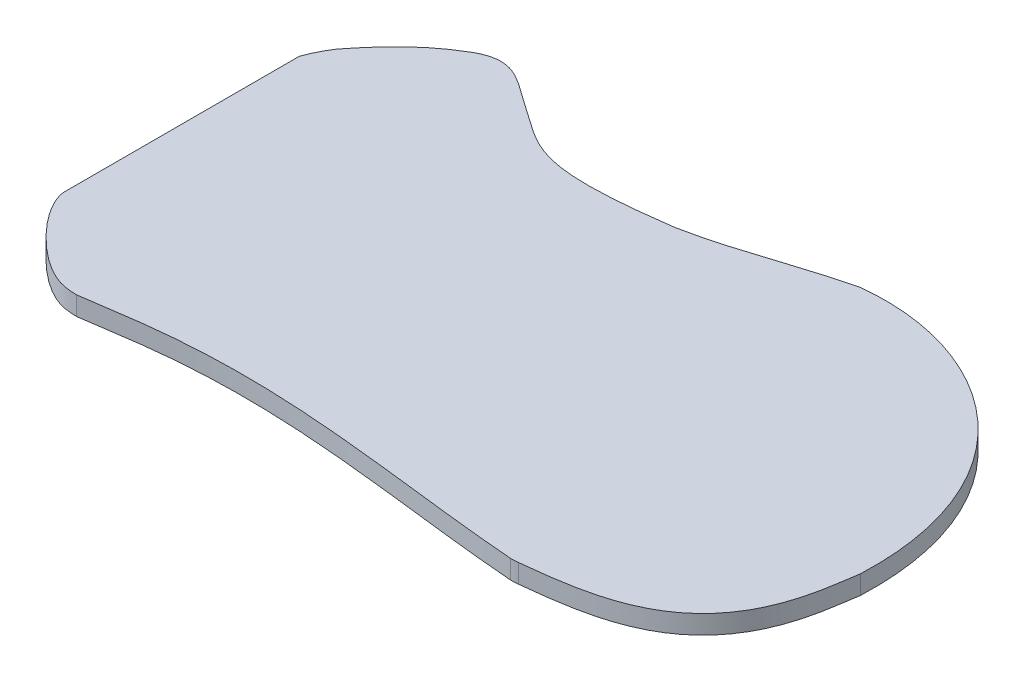
from build123d import *

# Parameters (mm, degrees)
BOSS_EXTRUDE2_DEPTH      = 4
SKETCH2_R                = 6
BOSS_EXTRUDE3_DEPTH      = 2.5
SKETCH4_R                = 2.5
CUT_EXTRUDE1_DEPTH       = 2.5
LPATTERN1_COUNT          = 3
LPATTERN1_PITCH          = 20
LPATTERN1_COUNT_DIR2     = 6
LPATTERN1_PITCH_DIR2     = 20
MIRROR1_COPY_1_SKETCH_R  = 6
MIRROR1_COPY_1_DEPTH     = 2.5
MIRROR1_COPY_2_SKETCH_R  = 6
MIRROR1_COPY_2_DEPTH     = 2.5
MIRROR1_COPY_3_SKETCH_R  = 6
MIRROR1_COPY_3_DEPTH     = 2.5
MIRROR1_COPY_4_SKETCH_R  = 6
MIRROR1_COPY_4_DEPTH     = 2.5
MIRROR1_COPY_5_SKETCH_R  = 6
MIRROR1_COPY_5_DEPTH     = 2.5
MIRROR1_COPY_6_SKETCH_R  = 6
MIRROR1_COPY_6_DEPTH     = 2.5
MIRROR1_COPY_7_SKETCH_R  = 6
MIRROR1_COPY_7_DEPTH     = 2.5
MIRROR1_COPY_8_SKETCH_R  = 6
MIRROR1_COPY_8_DEPTH     = 2.5
MIRROR1_COPY_9_SKETCH_R  = 6
MIRROR1_COPY_9_DEPTH     = 2.5
MIRROR1_COPY_10_SKETCH_R = 6
MIRROR1_COPY_10_DEPTH    = 2.5
MIRROR1_COPY_11_SKETCH_R = 6
MIRROR1_COPY_11_DEPTH    = 2.5
MIRROR1_COPY_12_SKETCH_R = 6
MIRROR1_COPY_12_DEPTH    = 2.5
MIRROR1_COPY_13_SKETCH_R = 6
MIRROR1_COPY_13_DEPTH    = 2.5
MIRROR1_COPY_14_SKETCH_R = 6
MIRROR1_COPY_14_DEPTH    = 2.5
MIRROR1_COPY_15_SKETCH_R = 6
MIRROR1_COPY_15_DEPTH    = 2.5
MIRROR1_COPY_16_SKETCH_R = 6
MIRROR1_COPY_16_DEPTH    = 2.5
MIRROR1_COPY_17_SKETCH_R = 6
MIRROR1_COPY_17_DEPTH    = 2.5
MIRROR1_COPY_18_SKETCH_R = 2.5
MIRROR1_COPY_18_DEPTH    = 2.5
MIRROR1_COPY_19_SKETCH_R = 2.5
MIRROR1_COPY_19_DEPTH    = 2.5
MIRROR1_COPY_20_SKETCH_R = 2.5
MIRROR1_COPY_20_DEPTH    = 2.5
MIRROR1_COPY_21_SKETCH_R = 2.5
MIRROR1_COPY_21_DEPTH    = 2.5
MIRROR1_COPY_22_SKETCH_R = 2.5
MIRROR1_COPY_22_DEPTH    = 2.5
MIRROR1_COPY_23_SKETCH_R = 2.5
MIRROR1_COPY_23_DEPTH    = 2.5
MIRROR1_COPY_24_SKETCH_R = 2.5
MIRROR1_COPY_24_DEPTH    = 2.5
MIRROR1_COPY_25_SKETCH_R = 2.5
MIRROR1_COPY_25_DEPTH    = 2.5
MIRROR1_COPY_26_SKETCH_R = 2.5
MIRROR1_COPY_26_DEPTH    = 2.5
MIRROR1_COPY_27_SKETCH_R = 2.5
MIRROR1_COPY_27_DEPTH    = 2.5
MIRROR1_COPY_28_SKETCH_R = 2.5
MIRROR1_COPY_28_DEPTH    = 2.5
MIRROR1_COPY_29_SKETCH_R = 2.5
MIRROR1_COPY_29_DEPTH    = 2.5
MIRROR1_COPY_30_SKETCH_R = 2.5
MIRROR1_COPY_30_DEPTH    = 2.5
MIRROR1_COPY_31_SKETCH_R = 2.5
MIRROR1_COPY_31_DEPTH    = 2.5
MIRROR1_COPY_32_SKETCH_R = 2.5
MIRROR1_COPY_32_DEPTH    = 2.5
MIRROR1_COPY_33_SKETCH_R = 2.5
MIRROR1_COPY_33_DEPTH    = 2.5
MIRROR1_COPY_34_SKETCH_R = 2.5
MIRROR1_COPY_34_DEPTH    = 2.5
CUT_EXTRUDE2_START       = -6.5
SKETCH5_W                = 217.065094255
SKETCH5_H                = 152.799445231
CUT_EXTRUDE2_DEPTH       = 6.5


with BuildPart() as part:
    # Sketch1 → Boss-Extrude2 (new body)
    with BuildSketch(Plane(origin=(0, 0, 0), x_dir=(1, 0, 0), z_dir=(0, 1, 0))):
        with BuildLine():
            Line((-77.610928287, 24.73480995), (-77.610926739, -10.995486899))
            Line((-77.610926739, -10.995486899), (77.512336703, -10.995486899))
            add(Edge.make_bspline(
                [(77.512336703, -10.995486899), (77.518560385, -10.957874405), (77.524814965, -10.920112686), (77.531107112, -10.882121857)],
                knots=[1.010486637, 1.010486637, 1.010486637, 1.010486637, 1.01412385, 1.01412385, 1.01412385, 1.01412385], degree=3))
            add(Edge.make_bspline(
                [(77.531107112, -10.882121857), (77.574839436, -9.766511083), (77.609892635, -7.507402328), (77.488817492, -4.272864758), (77.205757806, -1.125162749), (76.619514408, 2.937285367), (75.50877626, 7.753752623), (72.989524017, 14.905909338), (68.566776195, 22.780014071), (61.595696469, 30.463398286), (53.335691478, 36.314584962), (44.158321293, 40.264828436), (34.449835996, 42.250559646), (27.85746121, 42.205857253), (24.60638519, 41.843406408)],
                knots=[0.000169226, 0.000169226, 0.000169226, 0.000169226, 0.031413574, 0.062657922, 0.09390227, 0.125146618, 0.187635314, 0.25012401, 0.375101401, 0.500078793, 0.625056185, 0.750033577, 0.875010969, 0.999988361, 0.999988361, 0.999988361, 0.999988361], degree=3))
            add(Edge.make_bspline(
                [(24.60638519, 41.843406408), (19.441654305, 40.599557497), (11.868641969, 38.10186056), (1.706905963, 34.941445063), (-3.490903085, 33.661503777), (-6.113060784, 33.160531214)],
                knots=[0.000658959, 0.000658959, 0.000658959, 0.000658959, 0.498067368, 0.746771573, 0.995475778, 0.995475778, 0.995475778, 0.995475778], degree=3))
            add(Edge.make_bspline(
                [(-6.113060784, 33.160531214), (-7.141691771, 33.016316508), (-9.182526978, 32.742024746), (-13.41706461, 32.236967498), (-18.636406478, 31.76535684), (-24.35525076, 31.602322531), (-29.284430774, 31.960023989), (-33.420361612, 32.921566077), (-36.371506688, 34.261606006), (-38.649706949, 35.648097323), (-40.392953753, 36.835956096), (-41.960752384, 37.950009586), (-43.317594841, 38.899351268), (-44.070083407, 39.410677407), (-44.439121999, 39.658722592)],
                knots=[-0.00019559, -0.00019559, -0.00019559, -0.00019559, 0.062587211, 0.125370012, 0.250935613, 0.376501215, 0.502066816, 0.627632417, 0.753198019, 0.81598082, 0.87876362, 0.941546421, 0.972937821, 1.004329222, 1.004329222, 1.004329222, 1.004329222], degree=3))
            add(Edge.make_bspline(
                [(-44.439121999, 39.658722592), (-44.698278493, 39.837478936), (-45.221943057, 40.202686415), (-46.204449693, 40.903278583), (-47.345032131, 41.729218311), (-48.599765224, 42.619793879), (-50.15090873, 43.651280208), (-51.914572875, 44.618913698), (-53.861511808, 45.22944075), (-55.705524128, 45.327541985), (-57.164765963, 45.050979151), (-58.248551256, 44.683932663), (-59.000335406, 44.361625817), (-59.68368912, 44.01293032), (-60.037538284, 43.806100934), (-60.223947924, 43.693990747)],
                knots=[-0.002497219, -0.002497219, -0.002497219, -0.002497219, 0.029065652, 0.060628523, 0.123754265, 0.186880007, 0.250005749, 0.376257234, 0.502508718, 0.628760202, 0.755011687, 0.818137429, 0.881263171, 0.944388913, 1.007514655, 1.007514655, 1.007514655, 1.007514655], degree=3))
            add(Edge.make_bspline(
                [(-60.223947924, 43.693990747), (-60.647418813, 43.446259773), (-61.492438659, 42.931359573), (-63.090560833, 41.877343183), (-65.712449046, 39.946479206), (-68.970886279, 37.019932698), (-71.698068002, 34.035828956), (-73.643714468, 31.694824796), (-74.523586793, 30.588052824), (-74.969576783, 30.022283972)],
                knots=[0.000174078, 0.000174078, 0.000174078, 0.000174078, 0.062881444, 0.12558881, 0.251003541, 0.501833004, 0.752662466, 0.878077198, 1.003491929, 1.003491929, 1.003491929, 1.003491929], degree=3))
            add(Edge.make_bspline(
                [(-74.969576783, 30.022283972), (-75.519545883, 29.19186114), (-76.530249869, 27.448037515), (-77.287396087, 25.657695857), (-77.610928287, 24.73480995)],
                knots=[0.499549048, 0.499549048, 0.499549048, 0.499549048, 0.499765799, 0.49998255, 0.49998255, 0.49998255, 0.49998255], degree=3))
        make_face()
        with BuildLine():
            Line((77.512336703, -10.995486899), (-77.610926739, -10.995486899))
            Line((-77.610926739, -10.995486899), (-77.610926696, -11.995486899))
            Line((-77.610926696, -11.995486899), (77.352572442, -11.995486899))
            add(Edge.make_bspline(
                [(77.352572442, -11.995486899), (77.358645684, -11.955275612), (77.412259186, -11.602816601), (77.464316371, -11.285695229), (77.512336703, -10.995486899)],
                knots=[0.978851886, 0.978851886, 0.978851886, 0.978851886, 0.982422834, 1.010486637, 1.010486637, 1.010486637, 1.010486637], degree=3))
        make_face()
        with BuildLine():
            Line((77.352572442, -11.995486899), (-77.610926696, -11.995486899))
            Line((-77.610926696, -11.995486899), (-77.610926126, -25.14203309))
            add(Edge.make_bspline(
                [(-77.610926126, -25.14203309), (-77.610329581, -25.399956565), (-77.56299042, -25.903042711), (-77.289715127, -26.985745976), (-76.641681648, -28.530602527), (-75.497775654, -30.448110961), (-73.605831916, -33.039049782), (-70.803315368, -36.111993436), (-67.327412016, -39.127002194), (-64.140223394, -41.243972104), (-61.455644843, -42.436069514), (-59.281170991, -42.877843858), (-58.025592683, -42.909198362), (-57.3728408, -42.946603583)],
                knots=[0.000484301, 0.000484301, 0.000484301, 0.000484301, 0.031521334, 0.062558366, 0.124632431, 0.186706496, 0.248780561, 0.37292869, 0.49707682, 0.62122495, 0.745373079, 0.869521209, 0.993669339, 0.993669339, 0.993669339, 0.993669339], degree=3))
            add(Edge.make_bspline(
                [(-57.3728408, -42.946603583), (-57.13064829, -42.917162583), (-56.655899826, -42.857244252), (-55.632891969, -42.716833971), (-54.283173397, -42.517569574), (-52.529691334, -42.248220025), (-50.028198289, -41.865201142), (-46.600250729, -41.367044153), (-42.036258597, -40.811127611), (-37.051373779, -40.355934431), (-29.881163552, -39.94286355), (-20.010895236, -39.876612938), (-6.937670032, -40.617368244), (4.79101559, -41.816338855), (14.569227449, -42.959318591), (22.067232439, -43.838869966), (29.700051426, -44.671831852), (34.887053568, -45.137323321), (37.472492496, -45.32880882)],
                knots=[0.000538145, 0.000538145, 0.000538145, 0.000538145, 0.016151963, 0.031765781, 0.062993416, 0.094221052, 0.125448688, 0.18790396, 0.250359232, 0.312814503, 0.375269775, 0.500180319, 0.625090862, 0.750001406, 0.812456678, 0.874911949, 0.937367221, 0.999822493, 0.999822493, 0.999822493, 0.999822493], degree=3))
            ThreePointArc((37.472492496, -45.32880882), (38.248733412, -45.324262341), (39.021479233, -45.250543112))
            add(Edge.make_bspline(
                [(39.021479233, -45.250543112), (40.554063275, -45.087269156), (43.636191946, -44.744534775), (49.629747374, -43.872748427), (56.64310661, -42.215757501), (63.76459646, -38.913707507), (69.322535256, -34.215518596), (72.595951354, -29.308690908), (74.463908277, -25.056718438), (75.526739474, -21.803040338), (76.297079472, -18.602211114), (76.745734786, -16.093857572), (77.025988143, -14.25776708), (77.200159766, -13.042150967), (77.304730613, -12.312250405), (77.352572442, -11.995486899)],
                knots=[-0.000308659, -0.000308659, -0.000308659, -0.000308659, 0.063093373, 0.126495404, 0.253299468, 0.380103532, 0.506907596, 0.633711659, 0.697113691, 0.760515723, 0.823917755, 0.887319787, 0.919020803, 0.950721818, 0.978851886, 0.978851886, 0.978851886, 0.978851886], degree=3))
        make_face()
    boss_extrude2 = extrude(amount=BOSS_EXTRUDE2_DEPTH)

    # Sketch2 → Boss-Extrude3 (add)
    with BuildSketch(Plane(origin=(0, 4, 0), x_dir=(1, 0, 0), z_dir=(0, 1, 0))):
        with Locations(Location((-52.601285046, 19.444993701, 0), (0, 0, 270))):
            Circle(SKETCH2_R)
    boss_extrude3 = extrude(amount=BOSS_EXTRUDE3_DEPTH)

    # Sketch4 → Cut-Extrude1 (cut)
    with BuildSketch(Plane(origin=(0, 6.5, 0), x_dir=(1, 0, 0), z_dir=(0, 1, 0))):
        with Locations(Location((-52.601285046, 19.444993701, 0), (0, 0, 270))):
            Circle(SKETCH4_R)
    cut_extrude1 = extrude(amount=-CUT_EXTRUDE1_DEPTH, mode=Mode.SUBTRACT)

    # LPattern1: Boss-Extrude3, Cut-Extrude1 3 × 6
    with Locations(*[(j * LPATTERN1_PITCH_DIR2, 0, i * LPATTERN1_PITCH) for i in range(LPATTERN1_COUNT) for j in range(LPATTERN1_COUNT_DIR2) if (i, j) != (0, 0)]):
        add(boss_extrude3)
        add(cut_extrude1, mode=Mode.SUBTRACT)

    # Mirror1: Boss-Extrude2, Boss-Extrude3, Cut-Extrude1 across plane
    add(boss_extrude2.mirror(Plane(origin=(0, 0, 0), x_dir=(0, 0, 1), z_dir=(0, -1, 0))))
    add(boss_extrude3.mirror(Plane(origin=(0, 0, 0), x_dir=(0, 0, 1), z_dir=(0, -1, 0))))
    add(cut_extrude1.mirror(Plane(origin=(0, 0, 0), x_dir=(0, 0, 1), z_dir=(0, -1, 0))), mode=Mode.SUBTRACT)

    # Mirror1 copy 1 sketch → Mirror1 copy 1 (add)
    with BuildSketch(Plane(origin=(20, -4, -8.66e-07), x_dir=(1, 0, 0), z_dir=(0, -1, 0))):
        with Locations((-52.601285046, -19.444993701)):
            Circle(MIRROR1_COPY_1_SKETCH_R)
    extrude(amount=MIRROR1_COPY_1_DEPTH)

    # Mirror1 copy 2 sketch → Mirror1 copy 2 (add)
    with BuildSketch(Plane(origin=(40, -4, -1.733e-06), x_dir=(1, 0, 0), z_dir=(0, -1, 0))):
        with Locations((-52.601285046, -19.444993701)):
            Circle(MIRROR1_COPY_2_SKETCH_R)
    extrude(amount=MIRROR1_COPY_2_DEPTH)

    # Mirror1 copy 3 sketch → Mirror1 copy 3 (add)
    with BuildSketch(Plane(origin=(60, -4, -2.599e-06), x_dir=(1, 0, 0), z_dir=(0, -1, 0))):
        with Locations((-52.601285046, -19.444993701)):
            Circle(MIRROR1_COPY_3_SKETCH_R)
    extrude(amount=MIRROR1_COPY_3_DEPTH)

    # Mirror1 copy 4 sketch → Mirror1 copy 4 (add)
    with BuildSketch(Plane(origin=(80, -4, -3.465e-06), x_dir=(1, 0, 0), z_dir=(0, -1, 0))):
        with Locations((-52.601285046, -19.444993701)):
            Circle(MIRROR1_COPY_4_SKETCH_R)
    extrude(amount=MIRROR1_COPY_4_DEPTH)

    # Mirror1 copy 5 sketch → Mirror1 copy 5 (add)
    with BuildSketch(Plane(origin=(100, -4, -4.332e-06), x_dir=(1, 0, 0), z_dir=(0, -1, 0))):
        with Locations((-52.601285046, -19.444993701)):
            Circle(MIRROR1_COPY_5_SKETCH_R)
    extrude(amount=MIRROR1_COPY_5_DEPTH)

    # Mirror1 copy 6 sketch → Mirror1 copy 6 (add)
    with BuildSketch(Plane(origin=(8.66e-07, -4, 20), x_dir=(1, 0, 0), z_dir=(0, -1, 0))):
        with Locations((-52.601285046, -19.444993701)):
            Circle(MIRROR1_COPY_6_SKETCH_R)
    extrude(amount=MIRROR1_COPY_6_DEPTH)

    # Mirror1 copy 7 sketch → Mirror1 copy 7 (add)
    with BuildSketch(Plane(origin=(20.000000866, -4, 19.999999134), x_dir=(1, 0, 0), z_dir=(0, -1, 0))):
        with Locations((-52.601285046, -19.444993701)):
            Circle(MIRROR1_COPY_7_SKETCH_R)
    extrude(amount=MIRROR1_COPY_7_DEPTH)

    # Mirror1 copy 8 sketch → Mirror1 copy 8 (add)
    with BuildSketch(Plane(origin=(40.000000866, -4, 19.999998267), x_dir=(1, 0, 0), z_dir=(0, -1, 0))):
        with Locations((-52.601285046, -19.444993701)):
            Circle(MIRROR1_COPY_8_SKETCH_R)
    extrude(amount=MIRROR1_COPY_8_DEPTH)

    # Mirror1 copy 9 sketch → Mirror1 copy 9 (add)
    with BuildSketch(Plane(origin=(60.000000866, -4, 19.999997401), x_dir=(1, 0, 0), z_dir=(0, -1, 0))):
        with Locations((-52.601285046, -19.444993701)):
            Circle(MIRROR1_COPY_9_SKETCH_R)
    extrude(amount=MIRROR1_COPY_9_DEPTH)

    # Mirror1 copy 10 sketch → Mirror1 copy 10 (add)
    with BuildSketch(Plane(origin=(80.000000866, -4, 19.999996535), x_dir=(1, 0, 0), z_dir=(0, -1, 0))):
        with Locations((-52.601285046, -19.444993701)):
            Circle(MIRROR1_COPY_10_SKETCH_R)
    extrude(amount=MIRROR1_COPY_10_DEPTH)

    # Mirror1 copy 11 sketch → Mirror1 copy 11 (add)
    with BuildSketch(Plane(origin=(100.000000866, -4, 19.999995668), x_dir=(1, 0, 0), z_dir=(0, -1, 0))):
        with Locations((-52.601285046, -19.444993701)):
            Circle(MIRROR1_COPY_11_SKETCH_R)
    extrude(amount=MIRROR1_COPY_11_DEPTH)

    # Mirror1 copy 12 sketch → Mirror1 copy 12 (add)
    with BuildSketch(Plane(origin=(1.733e-06, -4, 40), x_dir=(1, 0, 0), z_dir=(0, -1, 0))):
        with Locations((-52.601285046, -19.444993701)):
            Circle(MIRROR1_COPY_12_SKETCH_R)
    extrude(amount=MIRROR1_COPY_12_DEPTH)

    # Mirror1 copy 13 sketch → Mirror1 copy 13 (add)
    with BuildSketch(Plane(origin=(20.000001733, -4, 39.999999134), x_dir=(1, 0, 0), z_dir=(0, -1, 0))):
        with Locations((-52.601285046, -19.444993701)):
            Circle(MIRROR1_COPY_13_SKETCH_R)
    extrude(amount=MIRROR1_COPY_13_DEPTH)

    # Mirror1 copy 14 sketch → Mirror1 copy 14 (add)
    with BuildSketch(Plane(origin=(40.000001733, -4, 39.999998267), x_dir=(1, 0, 0), z_dir=(0, -1, 0))):
        with Locations((-52.601285046, -19.444993701)):
            Circle(MIRROR1_COPY_14_SKETCH_R)
    extrude(amount=MIRROR1_COPY_14_DEPTH)

    # Mirror1 copy 15 sketch → Mirror1 copy 15 (add)
    with BuildSketch(Plane(origin=(60.000001733, -4, 39.999997401), x_dir=(1, 0, 0), z_dir=(0, -1, 0))):
        with Locations((-52.601285046, -19.444993701)):
            Circle(MIRROR1_COPY_15_SKETCH_R)
    extrude(amount=MIRROR1_COPY_15_DEPTH)

    # Mirror1 copy 16 sketch → Mirror1 copy 16 (add)
    with BuildSketch(Plane(origin=(80.000001733, -4, 39.999996535), x_dir=(1, 0, 0), z_dir=(0, -1, 0))):
        with Locations((-52.601285046, -19.444993701)):
            Circle(MIRROR1_COPY_16_SKETCH_R)
    extrude(amount=MIRROR1_COPY_16_DEPTH)

    # Mirror1 copy 17 sketch → Mirror1 copy 17 (add)
    with BuildSketch(Plane(origin=(100.000001733, -4, 39.999995668), x_dir=(1, 0, 0), z_dir=(0, -1, 0))):
        with Locations((-52.601285046, -19.444993701)):
            Circle(MIRROR1_COPY_17_SKETCH_R)
    extrude(amount=MIRROR1_COPY_17_DEPTH)

    # Mirror1 copy 18 sketch → Mirror1 copy 18 (cut)
    with BuildSketch(Plane(origin=(20, -6.5, -8.66e-07), x_dir=(1, 0, 0), z_dir=(0, -1, 0))):
        with Locations((-52.601285046, -19.444993701)):
            Circle(MIRROR1_COPY_18_SKETCH_R)
    extrude(amount=-MIRROR1_COPY_18_DEPTH, mode=Mode.SUBTRACT)

    # Mirror1 copy 19 sketch → Mirror1 copy 19 (cut)
    with BuildSketch(Plane(origin=(40, -6.5, -1.733e-06), x_dir=(1, 0, 0), z_dir=(0, -1, 0))):
        with Locations((-52.601285046, -19.444993701)):
            Circle(MIRROR1_COPY_19_SKETCH_R)
    extrude(amount=-MIRROR1_COPY_19_DEPTH, mode=Mode.SUBTRACT)

    # Mirror1 copy 20 sketch → Mirror1 copy 20 (cut)
    with BuildSketch(Plane(origin=(60, -6.5, -2.599e-06), x_dir=(1, 0, 0), z_dir=(0, -1, 0))):
        with Locations((-52.601285046, -19.444993701)):
            Circle(MIRROR1_COPY_20_SKETCH_R)
    extrude(amount=-MIRROR1_COPY_20_DEPTH, mode=Mode.SUBTRACT)

    # Mirror1 copy 21 sketch → Mirror1 copy 21 (cut)
    with BuildSketch(Plane(origin=(80, -6.5, -3.465e-06), x_dir=(1, 0, 0), z_dir=(0, -1, 0))):
        with Locations((-52.601285046, -19.444993701)):
            Circle(MIRROR1_COPY_21_SKETCH_R)
    extrude(amount=-MIRROR1_COPY_21_DEPTH, mode=Mode.SUBTRACT)

    # Mirror1 copy 22 sketch → Mirror1 copy 22 (cut)
    with BuildSketch(Plane(origin=(100, -6.5, -4.332e-06), x_dir=(1, 0, 0), z_dir=(0, -1, 0))):
        with Locations((-52.601285046, -19.444993701)):
            Circle(MIRROR1_COPY_22_SKETCH_R)
    extrude(amount=-MIRROR1_COPY_22_DEPTH, mode=Mode.SUBTRACT)

    # Mirror1 copy 23 sketch → Mirror1 copy 23 (cut)
    with BuildSketch(Plane(origin=(8.66e-07, -6.5, 20), x_dir=(1, 0, 0), z_dir=(0, -1, 0))):
        with Locations((-52.601285046, -19.444993701)):
            Circle(MIRROR1_COPY_23_SKETCH_R)
    extrude(amount=-MIRROR1_COPY_23_DEPTH, mode=Mode.SUBTRACT)

    # Mirror1 copy 24 sketch → Mirror1 copy 24 (cut)
    with BuildSketch(Plane(origin=(20.000000866, -6.5, 19.999999134), x_dir=(1, 0, 0), z_dir=(0, -1, 0))):
        with Locations((-52.601285046, -19.444993701)):
            Circle(MIRROR1_COPY_24_SKETCH_R)
    extrude(amount=-MIRROR1_COPY_24_DEPTH, mode=Mode.SUBTRACT)

    # Mirror1 copy 25 sketch → Mirror1 copy 25 (cut)
    with BuildSketch(Plane(origin=(40.000000866, -6.5, 19.999998267), x_dir=(1, 0, 0), z_dir=(0, -1, 0))):
        with Locations((-52.601285046, -19.444993701)):
            Circle(MIRROR1_COPY_25_SKETCH_R)
    extrude(amount=-MIRROR1_COPY_25_DEPTH, mode=Mode.SUBTRACT)

    # Mirror1 copy 26 sketch → Mirror1 copy 26 (cut)
    with BuildSketch(Plane(origin=(60.000000866, -6.5, 19.999997401), x_dir=(1, 0, 0), z_dir=(0, -1, 0))):
        with Locations((-52.601285046, -19.444993701)):
            Circle(MIRROR1_COPY_26_SKETCH_R)
    extrude(amount=-MIRROR1_COPY_26_DEPTH, mode=Mode.SUBTRACT)

    # Mirror1 copy 27 sketch → Mirror1 copy 27 (cut)
    with BuildSketch(Plane(origin=(80.000000866, -6.5, 19.999996535), x_dir=(1, 0, 0), z_dir=(0, -1, 0))):
        with Locations((-52.601285046, -19.444993701)):
            Circle(MIRROR1_COPY_27_SKETCH_R)
    extrude(amount=-MIRROR1_COPY_27_DEPTH, mode=Mode.SUBTRACT)

    # Mirror1 copy 28 sketch → Mirror1 copy 28 (cut)
    with BuildSketch(Plane(origin=(100.000000866, -6.5, 19.999995668), x_dir=(1, 0, 0), z_dir=(0, -1, 0))):
        with Locations((-52.601285046, -19.444993701)):
            Circle(MIRROR1_COPY_28_SKETCH_R)
    extrude(amount=-MIRROR1_COPY_28_DEPTH, mode=Mode.SUBTRACT)

    # Mirror1 copy 29 sketch → Mirror1 copy 29 (cut)
    with BuildSketch(Plane(origin=(1.733e-06, -6.5, 40), x_dir=(1, 0, 0), z_dir=(0, -1, 0))):
        with Locations((-52.601285046, -19.444993701)):
            Circle(MIRROR1_COPY_29_SKETCH_R)
    extrude(amount=-MIRROR1_COPY_29_DEPTH, mode=Mode.SUBTRACT)

    # Mirror1 copy 30 sketch → Mirror1 copy 30 (cut)
    with BuildSketch(Plane(origin=(20.000001733, -6.5, 39.999999134), x_dir=(1, 0, 0), z_dir=(0, -1, 0))):
        with Locations((-52.601285046, -19.444993701)):
            Circle(MIRROR1_COPY_30_SKETCH_R)
    extrude(amount=-MIRROR1_COPY_30_DEPTH, mode=Mode.SUBTRACT)

    # Mirror1 copy 31 sketch → Mirror1 copy 31 (cut)
    with BuildSketch(Plane(origin=(40.000001733, -6.5, 39.999998267), x_dir=(1, 0, 0), z_dir=(0, -1, 0))):
        with Locations((-52.601285046, -19.444993701)):
            Circle(MIRROR1_COPY_31_SKETCH_R)
    extrude(amount=-MIRROR1_COPY_31_DEPTH, mode=Mode.SUBTRACT)

    # Mirror1 copy 32 sketch → Mirror1 copy 32 (cut)
    with BuildSketch(Plane(origin=(60.000001733, -6.5, 39.999997401), x_dir=(1, 0, 0), z_dir=(0, -1, 0))):
        with Locations((-52.601285046, -19.444993701)):
            Circle(MIRROR1_COPY_32_SKETCH_R)
    extrude(amount=-MIRROR1_COPY_32_DEPTH, mode=Mode.SUBTRACT)

    # Mirror1 copy 33 sketch → Mirror1 copy 33 (cut)
    with BuildSketch(Plane(origin=(80.000001733, -6.5, 39.999996535), x_dir=(1, 0, 0), z_dir=(0, -1, 0))):
        with Locations((-52.601285046, -19.444993701)):
            Circle(MIRROR1_COPY_33_SKETCH_R)
    extrude(amount=-MIRROR1_COPY_33_DEPTH, mode=Mode.SUBTRACT)

    # Mirror1 copy 34 sketch → Mirror1 copy 34 (cut)
    with BuildSketch(Plane(origin=(100.000001733, -6.5, 39.999995668), x_dir=(1, 0, 0), z_dir=(0, -1, 0))):
        with Locations((-52.601285046, -19.444993701)):
            Circle(MIRROR1_COPY_34_SKETCH_R)
    extrude(amount=-MIRROR1_COPY_34_DEPTH, mode=Mode.SUBTRACT)

    # Sketch5 → Cut-Extrude2 (cut)
    with BuildSketch(Plane(origin=(0, 6.5, 0), x_dir=(1, 0, 0), z_dir=(0, 1, 0)).offset(CUT_EXTRUDE2_START)):
        with Locations((-1.17117102, -0.337057599)):
            Rectangle(SKETCH5_W, SKETCH5_H)
    extrude(amount=CUT_EXTRUDE2_DEPTH, mode=Mode.SUBTRACT)


solid = part.part
